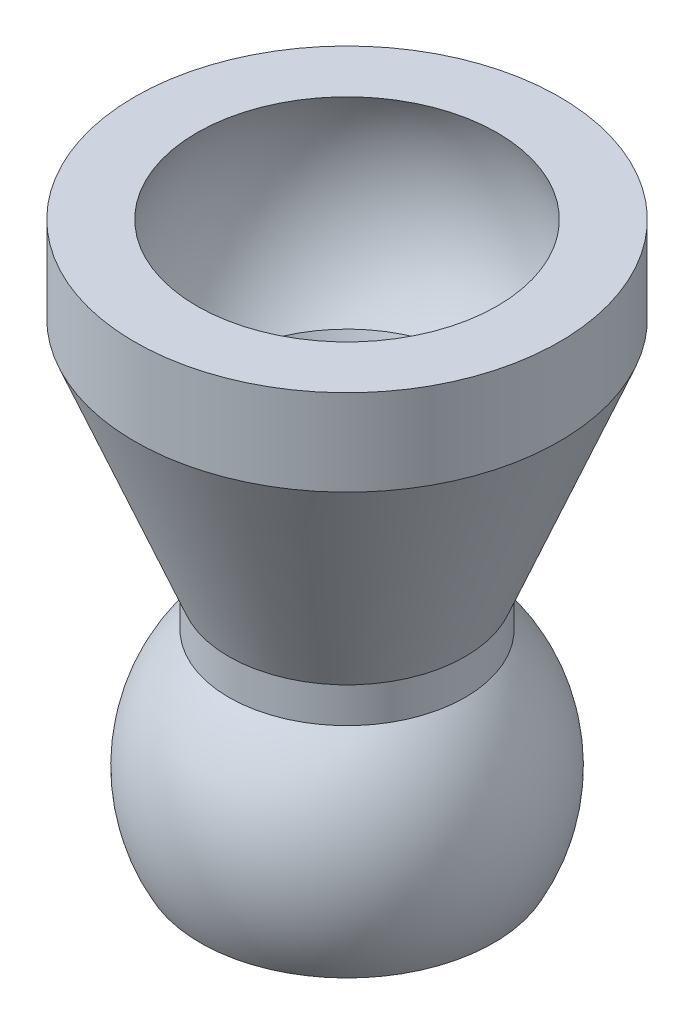
from build123d import *


with BuildPart() as part:
    # Croquis1 → Revolución1 (revolve)
    with BuildSketch(Plane.XY):
        with BuildLine():
            Line((2.288621504, 0), (0, 0))
            Line((0, 0), (0, -3.17))
            Line((0, -3.17), (3.465, -11.76))
            Line((3.465, -11.76), (5.165, -11.76))
            Line((5.165, -11.76), (5.165, -11.43004663))
            Line((5.165, -11.43004663), (3.2627067, -6.714116055))
            ThreePointArc((3.2627067, -6.714116055), (2.140427602, -4.914602613), (1.7, -2.84004663))
            ThreePointArc((1.7, -2.84004663), (1.823561842, -1.38463429), (2.288621504, 0))
        make_face()
        with BuildLine():
            Line((5.165, -11.76), (3.465, -11.76))
            Line((3.465, -11.76), (3.465, -13.06))
            Line((3.465, -13.06), (4.667081528, -14.262081528))
            ThreePointArc((4.667081528, -14.262081528), (4.908103346, -14.038251376), (5.165, -13.83283579))
            Line((5.165, -13.83283579), (5.165, -11.76))
        make_face()
        with BuildLine():
            Line((4.667081528, -14.262081528), (3.465, -13.06))
            Line((3.465, -13.06), (3.465, -16.464646325))
            ThreePointArc((3.465, -16.464646325), (3.907580372, -15.276881881), (4.667081528, -14.262081528))
        make_face()
        with BuildLine():
            Line((3.465, -16.464646325), (3.465, -13.06))
            ThreePointArc((3.465, -13.06), (1.725988008, -16.53567688), (2.418118888, -20.36))
            Line((2.418118888, -20.36), (3.465, -20.36))
            Line((3.465, -20.36), (3.465, -18.352767084))
            ThreePointArc((3.465, -18.352767084), (3.363706704, -17.408706704), (3.465, -16.464646325))
        make_face()
        with BuildLine():
            Line((3.465, -18.352767084), (3.465, -16.464646325))
            ThreePointArc((3.465, -16.464646325), (3.363706704, -17.408706704), (3.465, -18.352767084))
        make_face()
        with BuildLine():
            ThreePointArc((3.909582187, -19.544195349), (3.644512403, -18.964444111), (3.465, -18.352767084))
            Line((3.465, -18.352767084), (3.465, -20.36))
            Line((3.465, -20.36), (4.355813233, -20.36))
            Line((4.355813233, -20.36), (3.909582187, -19.544195349))
        make_face()
    revolve(axis=Axis((7.813706704, 0, 0), (0, -1, 0)))


solid = part.part
